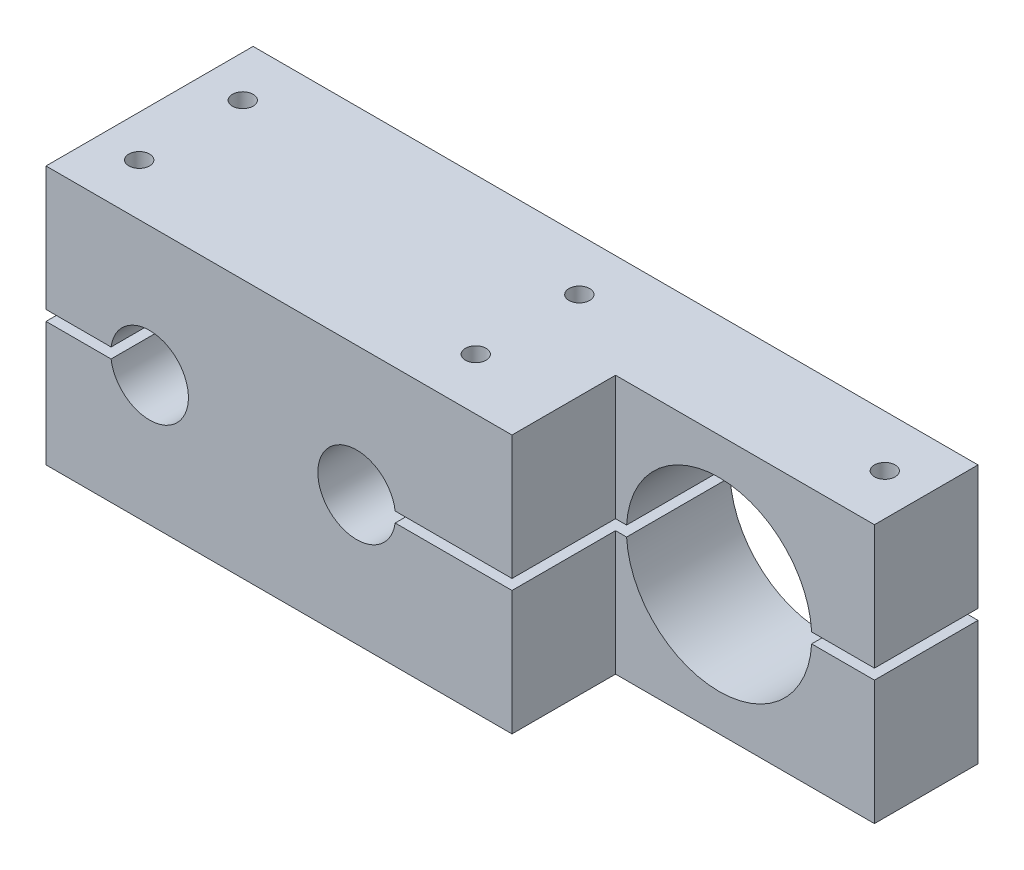
from build123d import *

# Parameters (mm, degrees)
EXTRUDE_1_DEPTH     = 40
SKETCH_8_R          = 2
SKETCH_8_W          = 50
SKETCH_8_H          = 20
CUT_EXTRUDE_1_DEPTH = 50


with BuildPart() as part:
    # Эскиз1 → Бобышка-Вытянуть1 (new body)
    with BuildSketch(Plane.XY):
        with BuildLine():
            Line((67.432912675, 26.000904174), (92.128005404, 26.000904174))
            ThreePointArc((92.128005404, 26.000904174), (110, 42.9), (127.871994596, 26.000904174))
            Line((127.871994596, 26.000904174), (140, 26.000904174))
            Line((140, 26.000904174), (140, 50))
            Line((140, 50), (0, 50))
            Line((0, 50), (0, 26))
            Line((0, 26), (12.566965626, 26))
            ThreePointArc((12.566965626, 26), (27.5, 25), (12.566965626, 24))
            Line((12.566965626, 24), (0, 24))
            Line((0, 24), (0, 0))
            Line((0, 0), (140, 0))
            Line((140, 0), (140, 23.999095826))
            Line((140, 23.999095826), (127.871994596, 23.999095826))
            ThreePointArc((127.871994596, 23.999095826), (110, 7.1), (92.128005404, 23.999095826))
            Line((92.128005404, 23.999095826), (67.432912675, 23.999095826))
            ThreePointArc((67.432912675, 23.999095826), (52.5, 25), (67.432912675, 26.000904174))
        make_face()
    extrude(amount=EXTRUDE_1_DEPTH)

    # Эскиз8 → Вырез-Вытянуть1 (cut)
    with BuildSketch(Plane.XZ):
        with Locations(Location((8, 30, 0), (0, 0, 270))):
            Circle(SKETCH_8_R)
        with Locations(Location((8, 10, 0), (0, 0, 270))):
            Circle(SKETCH_8_R)
        with Locations(Location((132, 10, 0), (0, 0, 270))):
            Circle(SKETCH_8_R)
        with Locations(Location((73, 30, 0), (0, 0, 270))):
            Circle(SKETCH_8_R)
        with Locations(Location((73, 10, 0), (0, 0, 270))):
            Circle(SKETCH_8_R)
        with Locations((115, 30)):
            Rectangle(SKETCH_8_W, SKETCH_8_H)
    extrude(amount=-CUT_EXTRUDE_1_DEPTH, mode=Mode.SUBTRACT)


solid = part.part
